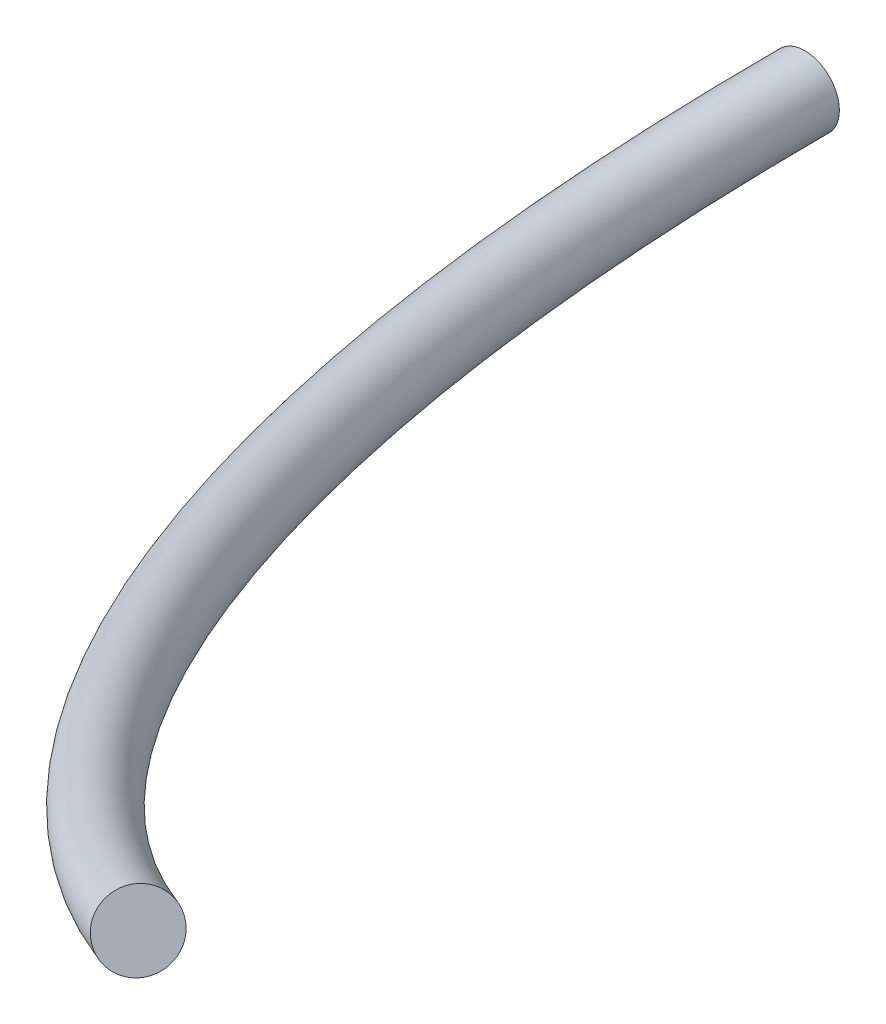
from build123d import *

# Parameters (mm, degrees)
SKETCH1_R = 50.8


with BuildPart() as part:
    # Sweep1: sweep along a path in Sketch2
    with BuildLine(Plane(origin=(6061.805627947, -13582.410506003, 0), x_dir=(-0.9131711152024589, -0.4075466429884856, -0.0049242409276578965), z_dir=(-0.4075515842041507, 0.913182186758309, -4.047326709888388e-15))) as sweep1_path:
        ThreePointArc((9750.565084605, 48.014713795), (9437.917400457, 1212.561850218), (8592.478990622, 2072.301637904))
    # Sketch1 → Sweep1 (sweep)
    with BuildSketch(Plane.XY):
        with Locations((-2842.344673376, -17556.316933349)):
            Circle(SKETCH1_R)
    sweep(path=sweep1_path.line)


solid = part.part
